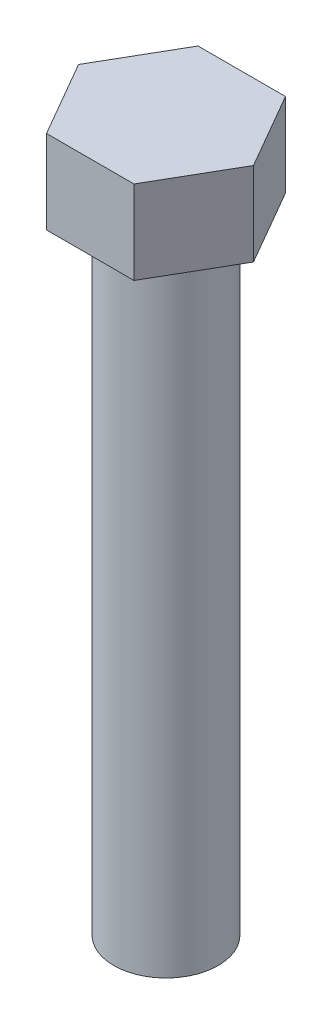
from build123d import *

# Parameters (mm, degrees)
SKETCH_1_R      = 50
EXTRUDE_1_DEPTH = 600
EXTRUDE_2_DEPTH = 80


with BuildPart() as part:
    # ｽｹｯﾁ1 → ﾎﾞｽ - 押し出し1 (new body)
    with BuildSketch(Plane(origin=(0, 0, 0), x_dir=(1, 0, 0), z_dir=(0, 1, 0))):
        Circle(SKETCH_1_R)
    extrude(amount=-EXTRUDE_1_DEPTH)

    # ｽｹｯﾁ2 → ﾎﾞｽ - 押し出し2 (add)
    with BuildSketch(Plane(origin=(0, 0, 0), x_dir=(1, 0, 0), z_dir=(0, 1, 0))):
        Polygon((41.857894516, -72.5), (83.715789032, 0), (41.857894516, 72.5), (-41.857894516, 72.5), (-83.715789032, 0), (-41.857894516, -72.5), align=None)
    extrude(amount=EXTRUDE_2_DEPTH)


solid = part.part
